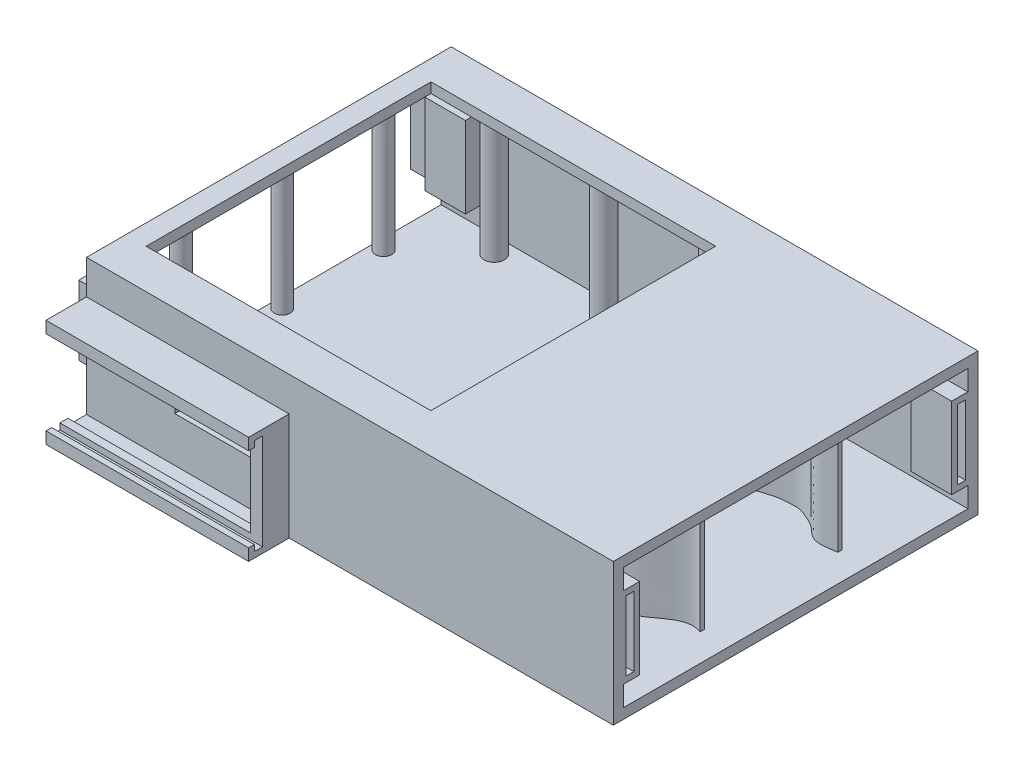
from build123d import *

# Parameters (mm, degrees)
SKETCH_1_W               = 130
SKETCH_1_H               = 90
EXTRUDE_1_DEPTH          = 35
SKETCH_2_W               = 85
SKETCH_2_H               = 30
CUT_EXTRUDE_1_DEPTH      = 143.29896931
SKETCH_3_W               = 4
SKETCH_3_H               = 20
EXTRUDE_2_DEPTH          = 10
SKETCH_4_W               = 2
SKETCH_4_H               = 17.171572876
EXTRUDE_3_DEPTH          = 5
SKETCH_5_W               = 20
SKETCH_5_H               = 10
CUT_EXTRUDE_2_DEPTH      = 5
SKETCH_6_W               = 10
SKETCH_6_H               = 26.54
EXTRUDE_4_DEPTH          = 50
SKETCH_7_W               = 8.585786437
SKETCH_7_H               = 23.711572876
CUT_EXTRUDE_3_DEPTH      = 47
CUT_EXTRUDE_4_DEPTH      = 146.022856825
SKETCH_9_W               = 1.998646116
SKETCH_9_H               = 1.465786438
SKETCH_9_H_2             = 1.495786438
EXTRUDE_5_DEPTH          = 47
CUT_EXTRUDE_5_DEPTH      = 105.979183659
CUT_EXTRUDE_5_DEPTH_BACK = 105.979183659
SKETCH_11_W              = 70.246659354
SKETCH_11_H              = 70.277403823
CUT_EXTRUDE_6_DEPTH      = 10
PATTERN_LINEAR_1_COUNT   = 2
PATTERN_LINEAR_1_PITCH   = 120
SKETCH_12_W              = 2
SKETCH_12_H              = 17.171572876
CUT_EXTRUDE_7_DEPTH      = 5
SKETCH_13_R              = 2
SKETCH_13_R_2            = 2.5
EXTRUDE_6_DEPTH          = 32


with BuildPart() as part:
    # Эскиз1 → Бобышка-Вытянуть1 (new body)
    with BuildSketch(Plane(origin=(0, 0, 0), x_dir=(1, 0, 0), z_dir=(0, 1, 0))):
        with Locations((-29.20081456, 1.086838325)):
            Rectangle(SKETCH_1_W, SKETCH_1_H)
    extrude(amount=EXTRUDE_1_DEPTH)

    # Эскиз2 → Вырез-Вытянуть1 (cut, through all)
    with BuildSketch(Plane.ZY.offset(94.20081456)):
        with Locations((-1.086838325, 17.5)):
            Rectangle(SKETCH_2_W, SKETCH_2_H)
    extrude(amount=-CUT_EXTRUDE_1_DEPTH, mode=Mode.SUBTRACT)

    # Эскиз3 → Бобышка-Вытянуть2 (add)
    with BuildSketch(Plane.ZY.offset(94.20081456)):
        with Locations((-41.586838325, 17.5)):
            Rectangle(SKETCH_3_W, SKETCH_3_H)
        with Locations((39.413161675, 17.5)):
            Rectangle(SKETCH_3_W, SKETCH_3_H)
    extrude_2 = extrude(amount=-EXTRUDE_2_DEPTH)

    # Эскиз4 → Бобышка-Вытянуть3 (add)
    with BuildSketch(Plane.ZY.offset(94.20081456)):
        with Locations((-42.001051888, 17.5)):
            Rectangle(SKETCH_4_W, SKETCH_4_H)
        with Locations((39.827375237, 17.5)):
            Rectangle(SKETCH_4_W, SKETCH_4_H)
    extrude(amount=EXTRUDE_3_DEPTH)

    # Эскиз5 → Вырез-Вытянуть2 (cut)
    with BuildSketch(Plane.XY.offset(43.913161675)):
        with Locations((-62.42097953, 17.5)):
            Rectangle(SKETCH_5_W, SKETCH_5_H)
    extrude(amount=-CUT_EXTRUDE_2_DEPTH, mode=Mode.SUBTRACT)

    # Эскиз6 → Бобышка-Вытянуть4 (add)
    with BuildSketch(Plane.ZY.offset(94.20081456)):
        with Locations((48.913161675, 13.27)):
            Rectangle(SKETCH_6_W, SKETCH_6_H)
    extrude(amount=-EXTRUDE_4_DEPTH)

    # Эскиз7 → Вырез-Вытянуть3 (cut)
    with BuildSketch(Plane.ZY.offset(94.20081456)):
        with Locations((48.206054894, 13.27)):
            Rectangle(SKETCH_7_W, SKETCH_7_H)
    extrude(amount=-CUT_EXTRUDE_3_DEPTH, mode=Mode.SUBTRACT)

    # Эскиз8 → Вырез-Вытянуть4 (cut, through all)
    with BuildSketch(Plane.ZY.offset(94.20081456)):
        Polygon((53.913161675, 2.91), (51.67649923, 2.91), (51.67649923, 23.66), (58.015589188, 23.66), (58.015589188, 2.91), align=None)
    extrude(amount=-CUT_EXTRUDE_4_DEPTH, mode=Mode.SUBTRACT)

    # Эскиз9 → Бобышка-Вытянуть5 (add)
    with BuildSketch(Plane.ZY.offset(94.20081456)):
        with Locations((49.499625054, 24.392893219)):
            Rectangle(SKETCH_9_W, SKETCH_9_H)
        with Locations((49.499625054, 2.162106781)):
            Rectangle(SKETCH_9_W, SKETCH_9_H_2)
    extrude(amount=-EXTRUDE_5_DEPTH)

    # Эскиз10 → Вырез-Вытянуть5 (cut, two sides: drawn at the far end of the back side and taken through both)
    with BuildSketch(Plane.ZY.offset(47.20081456).offset(-CUT_EXTRUDE_5_DEPTH_BACK)):
        Polygon((52.498948112, 23.66), (52.498948112, 25.125786438), (50.498948112, 25.125786438), (50.498948112, 23.66), (50.498948112, 2.91), (50.498948112, 1.414213562), (52.498948112, 1.414213562), (52.498948112, 2.91), align=None)
    extrude(amount=CUT_EXTRUDE_5_DEPTH + CUT_EXTRUDE_5_DEPTH_BACK, mode=Mode.SUBTRACT)

    # Эскиз11 → Вырез-Вытянуть6 (cut)
    with BuildSketch(Plane(origin=(0, 35, 0), x_dir=(1, 0, 0), z_dir=(0, 1, 0))):
        with Locations((-54.077484883, 0.948136413)):
            Rectangle(SKETCH_11_W, SKETCH_11_H)
    extrude(amount=-CUT_EXTRUDE_6_DEPTH, mode=Mode.SUBTRACT)

    # Линейный массив1: Бобышка-Вытянуть2 ×2
    with Locations(*[(i * PATTERN_LINEAR_1_PITCH, 0, 0) for i in range(1, PATTERN_LINEAR_1_COUNT)]):
        add(extrude_2)

    # Эскиз12 → Вырез-Вытянуть7 (cut)
    with BuildSketch(Plane(origin=(35.79918544, 0, 0), x_dir=(0, 0, -1), z_dir=(1, 0, 0))):
        with Locations((42.001051888, 17.5)):
            Rectangle(SKETCH_12_W, SKETCH_12_H)
        with Locations((-39.827375237, 17.5)):
            Rectangle(SKETCH_12_W, SKETCH_12_H)
    extrude(amount=-CUT_EXTRUDE_7_DEPTH, mode=Mode.SUBTRACT)

    # Эскиз13 → Бобышка-Вытянуть6 (add)
    with BuildSketch(Plane(origin=(0, 2.5, 0), x_dir=(1, 0, 0), z_dir=(0, 1, 0))):
        with Locations(Location((-91.618974163, 26.807003295, 0), (0, 0, 90))):
            Circle(SKETCH_13_R)
        with Locations(Location((-91.618974163, 1.807003295, 0), (0, 0, 90))):
            Circle(SKETCH_13_R)
        with Locations(Location((-91.618974163, -23.192996705, 0), (0, 0, 90))):
            Circle(SKETCH_13_R)
        with Locations(Location((-77.089166407, 39.586838325, 0), (0, 0, 90))):
            Circle(SKETCH_13_R_2)
        with Locations(Location((-50.089166407, 39.586838325, 0), (0, 0, 90))):
            Circle(SKETCH_13_R_2)
        with Locations(Location((-23.089166407, 39.586838325, 0), (0, 0, 90))):
            Circle(SKETCH_13_R_2)
        with Locations(Location((-77.089166407, -37.413161675, 0), (0, 0, 90))):
            Circle(SKETCH_13_R_2)
        with Locations(Location((-50.089166407, -37.413161675, 0), (0, 0, 90))):
            Circle(SKETCH_13_R_2)
        with Locations(Location((-23.089166407, -37.413161675, 0), (0, 0, 90))):
            Circle(SKETCH_13_R_2)
        with Locations(Location((-13.434770524, 26.807003295, 0), (0, 0, 90))):
            Circle(SKETCH_13_R_2)
        with Locations(Location((-13.434770524, 1.807003295, 0), (0, 0, 90))):
            Circle(SKETCH_13_R_2)
        with Locations(Location((-13.434770524, -23.192996705, 0), (0, 0, 90))):
            Circle(SKETCH_13_R_2)
        with BuildLine():
            Line((-5.685539721, 20.579942828), (-5.518611292, 18.270495038))
            add(Edge.make_bspline(
                [(-5.518611292, 18.270495038), (-4.977624078, 19.263571831), (-3.595194898, 18.449818605), (-1.689015731, 18.148962131), (0.042140553, 18.80834475), (2.007054458, 19.622956055), (3.961793837, 20.560345211), (5.994630873, 21.408790339), (8.12520892, 22.097401772), (10.147363608, 22.6295147), (12.363884299, 22.707165375), (14.52382628, 23.01281967), (16.624358552, 22.283384996), (18.413447504, 21.530665048), (20.084389151, 20.666593262), (21.451750041, 19.334240572), (24.081027211, 17.228189442), (27.187713744, 18.009470317), (29.047619772, 18.270495038)],
                knots=[0, 0, 0, 0, 0.070418621, 0.103338907, 0.158231693, 0.214988847, 0.278149225, 0.33389025, 0.393968407, 0.460317193, 0.502537936, 0.574387537, 0.634142017, 0.679586507, 0.733137093, 0.785087256, 0.834959162, 1, 1, 1, 1], degree=3))
            Line((29.047619772, 18.270495038), (29.047619772, 19.334530735))
            add(Edge.make_bspline(
                [(-5.685539721, 20.579942828), (-2.666397546, 18.467966227), (2.560284532, 21.548763252), (9.749794139, 24.167861761), (19.62779565, 25.169937288), (23.827666103, 17.601065621), (29.047619772, 19.334530735)],
                knots=[0, 0, 0, 0, 0.254290362, 0.44997543, 0.646169055, 1, 1, 1, 1], degree=3))
        make_face()
        with BuildLine():
            Line((-5.685539721, -16.965936238), (-5.518611292, -14.656488448))
            add(Edge.make_bspline(
                [(-5.518611292, -14.656488448), (-4.977624078, -15.649565241), (-3.595194898, -14.835812015), (-1.689015731, -14.534955541), (0.042140553, -15.19433816), (2.007054458, -16.008949465), (3.961793837, -16.946338621), (5.994630873, -17.794783749), (8.12520892, -18.483395182), (10.147363608, -19.01550811), (12.363884299, -19.093158785), (14.52382628, -19.398813081), (16.624358552, -18.669378406), (18.413447504, -17.916658458), (20.084389151, -17.052586672), (21.451750041, -15.720233982), (24.081027211, -13.614182852), (27.187713744, -14.395463727), (29.047619772, -14.656488448)],
                knots=[0, 0, 0, 0, 0.070418621, 0.103338907, 0.158231693, 0.214988847, 0.278149225, 0.33389025, 0.393968407, 0.460317193, 0.502537936, 0.574387537, 0.634142017, 0.679586507, 0.733137093, 0.785087256, 0.834959162, 1, 1, 1, 1], degree=3))
            Line((29.047619772, -14.656488448), (29.047619772, -15.720524145))
            add(Edge.make_bspline(
                [(-5.685539721, -16.965936238), (-2.666397546, -14.853959637), (2.560284532, -17.934756662), (9.749794139, -20.553855171), (19.62779565, -21.555930698), (23.827666103, -13.987059031), (29.047619772, -15.720524145)],
                knots=[0, 0, 0, 0, 0.254290362, 0.44997543, 0.646169055, 1, 1, 1, 1], degree=3))
        make_face()
    extrude(amount=EXTRUDE_6_DEPTH)


solid = part.part
